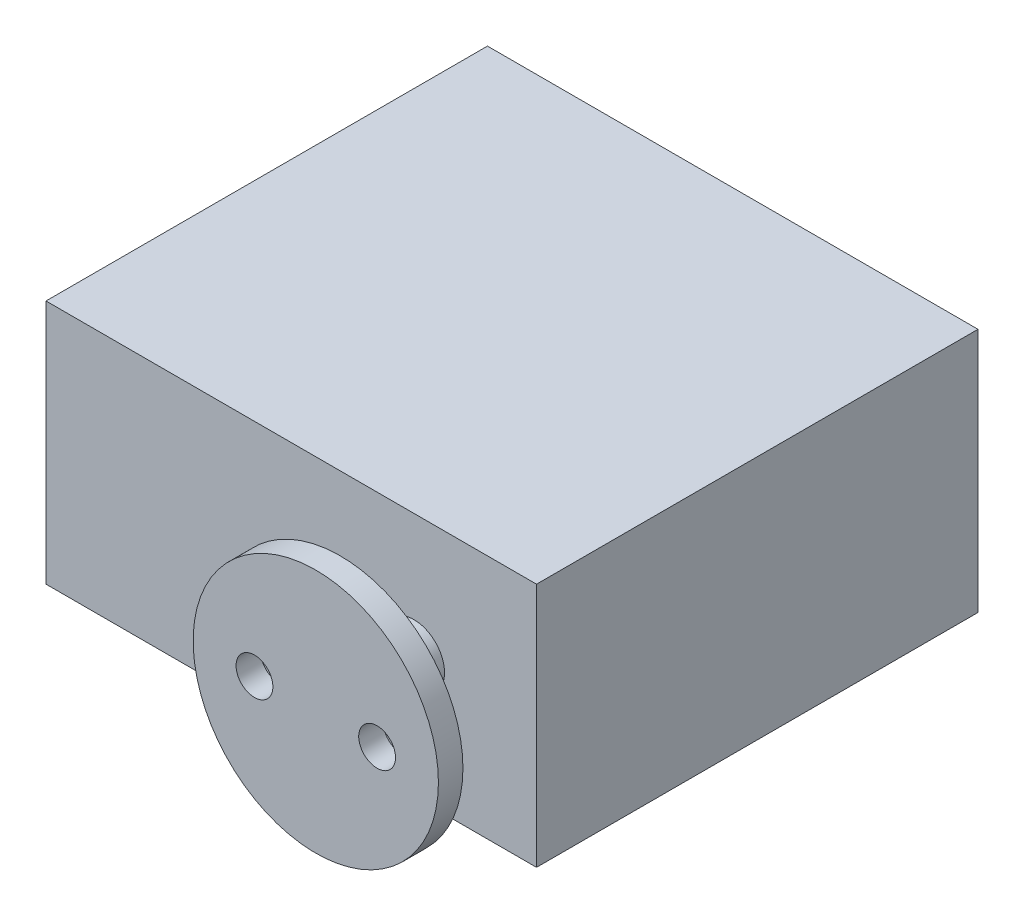
from build123d import *

# Parameters (mm, degrees)
SKETCH_1_W      = 40
SKETCH_1_H      = 20
EXTRUDE_1_DEPTH = 36
SKETCH_2_R      = 2.5
EXTRUDE_2_DEPTH = 6
SKETCH_4_R      = 10
SKETCH_4_R_2    = 1.5
EXTRUDE_3_DEPTH = 2


with BuildPart() as part:
    # Эскиз1 → Бобышка-Вытянуть1 (new body)
    with BuildSketch(Plane.XY):
        Rectangle(SKETCH_1_W, SKETCH_1_H)
    extrude(amount=EXTRUDE_1_DEPTH)

    # Эскиз2 → Бобышка-Вытянуть2 (add)
    with BuildSketch(Plane.XY.offset(36)):
        with Locations(Location((10, 0, 0), (0, 0, 180))):
            Circle(SKETCH_2_R)
    extrude(amount=EXTRUDE_2_DEPTH)

    # Эскиз4 → Бобышка-Вытянуть3 (add)
    with BuildSketch(Plane.XY.offset(42)):
        with Locations((10, 0)):
            Circle(SKETCH_4_R)
        with Locations((5, 0)):
            Circle(SKETCH_4_R_2, mode=Mode.SUBTRACT)
        with Locations((15, 0)):
            Circle(SKETCH_4_R_2, mode=Mode.SUBTRACT)
    extrude(amount=EXTRUDE_3_DEPTH)


solid = part.part
